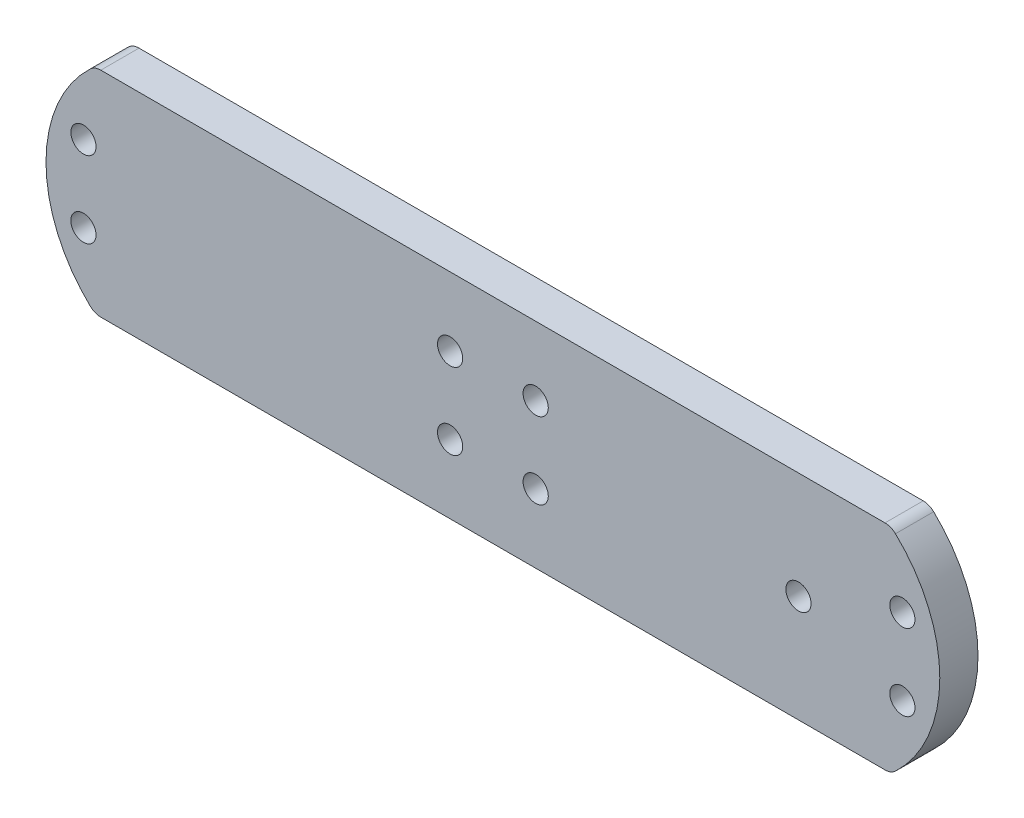
from build123d import *

# Parameters (mm, degrees)
EXTRUSION1_DEPTH      = 5
TROU_TARAUD_M3X0_51_D = 3.3
TROU_TARAUD_M4X0_71_D = 3.3


with BuildPart() as part:
    # Esquisse1 → Extrusion1 (new body)
    with BuildSketch(Plane.XY):
        with BuildLine():
            Line((11.324751653, -14), (-91.324751653, -14))
            ThreePointArc((-91.324751653, -14), (-92.063300599, -13.858640755), (-92.697448823, -13.454545455))
            ThreePointArc((-92.697448823, -13.454545455), (-98.5, 0), (-92.697448823, 13.454545455))
            ThreePointArc((-92.697448823, 13.454545455), (-92.063300599, 13.858640755), (-91.324751653, 14))
            Line((-91.324751653, 14), (11.324751653, 14))
            ThreePointArc((11.324751653, 14), (12.063300599, 13.858640755), (12.697448823, 13.454545455))
            ThreePointArc((12.697448823, 13.454545455), (18.5, 0), (12.697448823, -13.454545455))
            ThreePointArc((12.697448823, -13.454545455), (12.063300599, -13.858640755), (11.324751653, -14))
        make_face()
    extrude(amount=EXTRUSION1_DEPTH)

    # Trou taraudé M3x0.51 (through all)
    with Locations(Plane.XY.offset(5)):
        with Locations((-93.6, -5), (-93.6, 5), (-45.6, -5), (-45.6, 5), (-34.4, -5), (-34.4, 5), (13.6, -5), (13.6, 5)):
            Hole(TROU_TARAUD_M3X0_51_D / 2)

    # Trou taraudé M4x0.71 (through all)
    with Locations(Plane(origin=(0, 0, 0), x_dir=(-1, 0, 0), z_dir=(0, 0, -1))):
        with Locations((0, 0)):
            Hole(TROU_TARAUD_M4X0_71_D / 2)


solid = part.part
